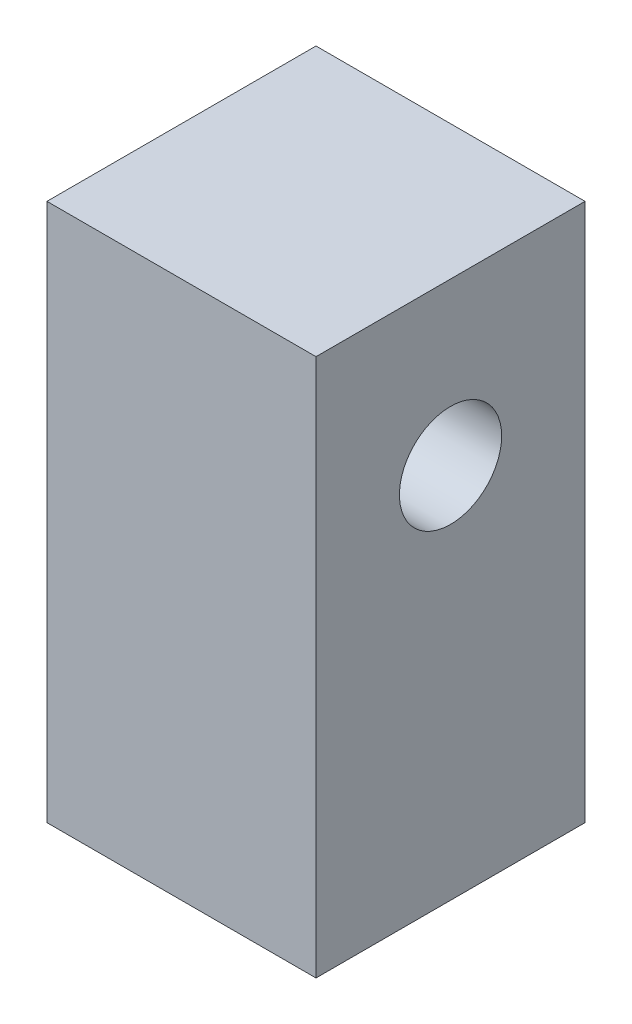
from build123d import *

# Parameters (mm, degrees)
CROQUIS1_W              = 12.7
CROQUIS1_H              = 12.7
SALIENTE_EXTRUIR1_DEPTH = 25.4
CROQUIS2_R              = 2.413
CORTAR_EXTRUIR1_DEPTH   = 25.4


with BuildPart() as part:
    # Croquis1 → Saliente-Extruir1 (new body)
    with BuildSketch(Plane(origin=(0, 0, 0), x_dir=(1, 0, 0), z_dir=(0, 1, 0))):
        Rectangle(CROQUIS1_W, CROQUIS1_H)
    extrude(amount=SALIENTE_EXTRUIR1_DEPTH)

    # Croquis2 → Cortar-Extruir1 (cut)
    with BuildSketch(Plane(origin=(6.35, 0, 0), x_dir=(0, 0, -1), z_dir=(1, 0, 0))):
        with Locations((0, 17.78)):
            Circle(CROQUIS2_R)
    extrude(amount=-CORTAR_EXTRUIR1_DEPTH, mode=Mode.SUBTRACT)


solid = part.part
